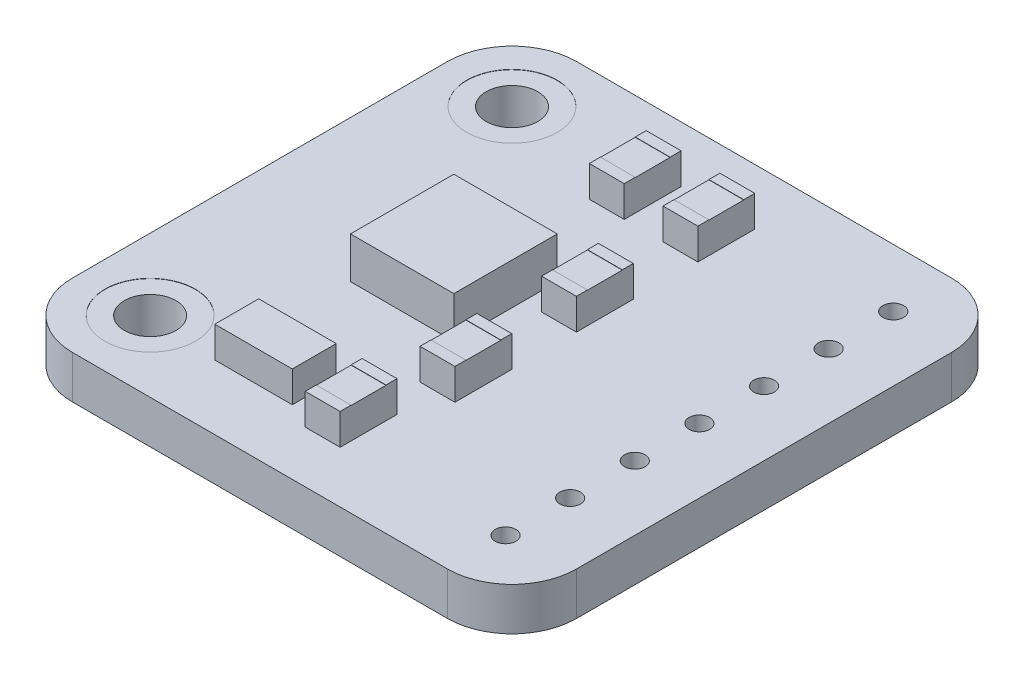
from build123d import *

# Parameters (mm, degrees)
BOSS_EXTRU_1_DEPTH              = 1.66
DIAM_TRE_DU_PER_AGE_2_0_2_1_D   = 2
ESQUISSE4_R                     = 1.75
ENL_V_MAT_EXTRU_1_DEPTH         = 0.01
DIAM_TRE_DU_PER_AGE_0_8_0_8_1_D = 0.8
ESQUISSE7_W                     = 4
ESQUISSE7_H                     = 4
BOSS_EXTRU_2_DEPTH              = 1.6
ESQUISSE8_W                     = 3
ESQUISSE8_H                     = 1.7
BOSS_EXTRU_3_DEPTH              = 1.2
ESQUISSE9_W                     = 1.35
ESQUISSE9_H                     = 2.2
BOSS_EXTRU_4_DEPTH              = 1.2
ESQUISSE10_W                    = 1.35
ESQUISSE10_H                    = 1.35
ENL_V_MAT_EXTRU_2_DEPTH         = 0.01
ESQUISSE13_W                    = 1.35
ESQUISSE13_H                    = 2.2
BOSS_EXTRU_6_DEPTH              = 1.2
ESQUISSE15_W                    = 1.35
ESQUISSE15_H                    = 1.35
ENL_V_MAT_EXTRU_3_DEPTH         = 0.01
ESQUISSE18_W                    = 1.35
ESQUISSE18_H                    = 2.2
BOSS_EXTRU_7_DEPTH              = 1.2
ESQUISSE20_W                    = 1.35
ESQUISSE20_H                    = 1.35
ENL_V_MAT_EXTRU_5_DEPTH         = 0.01
ESQUISSE23_W                    = 1.35
ESQUISSE23_H                    = 2.2
BOSS_EXTRU_9_DEPTH              = 1.2
ESQUISSE25_W                    = 1.35
ESQUISSE25_H                    = 1.35
ENL_V_MAT_EXTRU_6_DEPTH         = 0.01
ESQUISSE27_W                    = 1.35
ESQUISSE27_H                    = 2.2
BOSS_EXTRU_10_DEPTH             = 1.2
ESQUISSE29_W                    = 1.35
ESQUISSE29_H                    = 1.35
ENL_V_MAT_EXTRU_7_DEPTH         = 0.01


with BuildPart() as part:
    # Esquisse1 → Boss.-Extru.1 (new body)
    with BuildSketch(Plane(origin=(0, 0, 0), x_dir=(1, 0, 0), z_dir=(0, 1, 0))):
        with BuildLine():
            Line((-7.25, 9.75), (7.25, 9.75))
            ThreePointArc((7.25, 9.75), (9.017766953, 9.017766953), (9.75, 7.25))
            Line((9.75, 7.25), (9.75, -7.25))
            ThreePointArc((9.75, -7.25), (9.017766953, -9.017766953), (7.25, -9.75))
            Line((7.25, -9.75), (-7.25, -9.75))
            ThreePointArc((-7.25, -9.75), (-9.017766953, -9.017766953), (-9.75, -7.25))
            Line((-9.75, -7.25), (-9.75, 7.25))
            ThreePointArc((-9.75, 7.25), (-9.017766953, 9.017766953), (-7.25, 9.75))
        make_face()
    extrude(amount=BOSS_EXTRU_1_DEPTH)

    # Diamètre du perçage Ø2.0 (2)1 (through all)
    with Locations(Plane(origin=(0, 1.66, 0), x_dir=(1, 0, 0), z_dir=(0, 1, 0))):
        with Locations((-7, -7), (-7, 7)):
            Hole(DIAM_TRE_DU_PER_AGE_2_0_2_1_D / 2)

    # Esquisse4 → Enlèv. mat.-Extru.1 (cut)
    with BuildSketch(Plane(origin=(0, 1.66, 0), x_dir=(1, 0, 0), z_dir=(0, 1, 0))):
        with Locations((-7, 7)):
            Circle(ESQUISSE4_R)
        with Locations((-7, -7)):
            Circle(ESQUISSE4_R)
    extrude(amount=-ENL_V_MAT_EXTRU_1_DEPTH, mode=Mode.SUBTRACT)

    # Diamètre du perçage Ø0.8 (0.8)1 (through all)
    with Locations(Plane(origin=(0, 1.66, 0), x_dir=(1, 0, 0), z_dir=(0, 1, 0))):
        with Locations((7.25, 7.5), (7.25, 5), (7.25, 2.5), (7.25, 0), (7.25, -2.5), (7.25, -5), (7.25, -7.5)):
            Hole(DIAM_TRE_DU_PER_AGE_0_8_0_8_1_D / 2)

    # Esquisse7 → Boss.-Extru.2 (add)
    with BuildSketch(Plane(origin=(0, 1.66, 0), x_dir=(1, 0, 0), z_dir=(0, 1, 0))):
        with Locations((-2.25, 0)):
            Rectangle(ESQUISSE7_W, ESQUISSE7_H)
    extrude(amount=BOSS_EXTRU_2_DEPTH)

    # Esquisse8 → Boss.-Extru.3 (add)
    with BuildSketch(Plane(origin=(0, 1.66, 0), x_dir=(1, 0, 0), z_dir=(0, 1, 0))):
        with Locations((-2.75, -6.4)):
            Rectangle(ESQUISSE8_W, ESQUISSE8_H)
    extrude(amount=BOSS_EXTRU_3_DEPTH)

    # Esquisse9 → Boss.-Extru.4 (add)
    with BuildSketch(Plane(origin=(0, 1.66, 0), x_dir=(1, 0, 0), z_dir=(0, 1, 0))):
        with Locations((-1.713640357, 6.480344191)):
            Rectangle(ESQUISSE9_W, ESQUISSE9_H)
    extrude(amount=BOSS_EXTRU_4_DEPTH)

    # Esquisse10 → Enlèv. mat.-Extru.2 (cut)
    with BuildSketch(Plane(origin=(0, 2.86, 0), x_dir=(1, 0, 0), z_dir=(0, 1, 0))):
        with Locations((-1.713640357, 6.480344191)):
            Rectangle(ESQUISSE10_W, ESQUISSE10_H)
    extrude(amount=-ENL_V_MAT_EXTRU_2_DEPTH, mode=Mode.SUBTRACT)

    # Esquisse13 → Boss.-Extru.6 (add)
    with BuildSketch(Plane(origin=(5.041533198, 1.66, 0.171739912), x_dir=(1, 0, 0), z_dir=(0, 1, 0))):
        with Locations((-3.905173555, 6.652084103)):
            Rectangle(ESQUISSE13_W, ESQUISSE13_H)
    extrude(amount=BOSS_EXTRU_6_DEPTH)

    # Esquisse15 → Enlèv. mat.-Extru.3 (cut)
    with BuildSketch(Plane(origin=(5.041533198, 2.86, 0.171739912), x_dir=(1, 0, 0), z_dir=(0, 1, 0))):
        with Locations((-3.905173555, 6.652084103)):
            Rectangle(ESQUISSE15_W, ESQUISSE15_H)
    extrude(amount=-ENL_V_MAT_EXTRU_3_DEPTH, mode=Mode.SUBTRACT)

    # Esquisse18 → Boss.-Extru.7 (add)
    with BuildSketch(Plane(origin=(3.245250957, 1.66, 3.023332502), x_dir=(1, 0, 0), z_dir=(0, 1, 0))):
        with Locations((-2.108891314, 4.803676693)):
            Rectangle(ESQUISSE18_W, ESQUISSE18_H)
    extrude(amount=BOSS_EXTRU_7_DEPTH)

    # Esquisse20 → Enlèv. mat.-Extru.5 (cut)
    with BuildSketch(Plane(origin=(3.245250957, 2.86, 3.023332502), x_dir=(1, 0, 0), z_dir=(0, 1, 0))):
        with Locations((-2.108891314, 4.803676693)):
            Rectangle(ESQUISSE20_W, ESQUISSE20_H)
    extrude(amount=-ENL_V_MAT_EXTRU_5_DEPTH, mode=Mode.SUBTRACT)

    # Esquisse23 → Boss.-Extru.9 (add)
    with BuildSketch(Plane(origin=(5.945511171, 1.66, 6.874523991), x_dir=(1, 0, 0), z_dir=(0, 1, 0))):
        with Locations((-4.809151527, 3.954868182)):
            Rectangle(ESQUISSE23_W, ESQUISSE23_H)
    extrude(amount=BOSS_EXTRU_9_DEPTH)

    # Esquisse25 → Enlèv. mat.-Extru.6 (cut)
    with BuildSketch(Plane(origin=(5.945511171, 2.86, 6.874523991), x_dir=(1, 0, 0), z_dir=(0, 1, 0))):
        with Locations((-4.809151527, 3.954868182)):
            Rectangle(ESQUISSE25_W, ESQUISSE25_H)
    extrude(amount=-ENL_V_MAT_EXTRU_6_DEPTH, mode=Mode.SUBTRACT)

    # Esquisse27 → Boss.-Extru.10 (add)
    with BuildSketch(Plane(origin=(2.244432679, 1.66, 9.735089798), x_dir=(1, 0, 0), z_dir=(0, 1, 0))):
        with Locations((-1.819432679, 3.085089798)):
            Rectangle(ESQUISSE27_W, ESQUISSE27_H)
    extrude(amount=BOSS_EXTRU_10_DEPTH)

    # Esquisse29 → Enlèv. mat.-Extru.7 (cut)
    with BuildSketch(Plane(origin=(2.244432679, 2.86, 9.735089798), x_dir=(1, 0, 0), z_dir=(0, 1, 0))):
        with Locations((-1.819432679, 3.085089798)):
            Rectangle(ESQUISSE29_W, ESQUISSE29_H)
    extrude(amount=-ENL_V_MAT_EXTRU_7_DEPTH, mode=Mode.SUBTRACT)


solid = part.part
